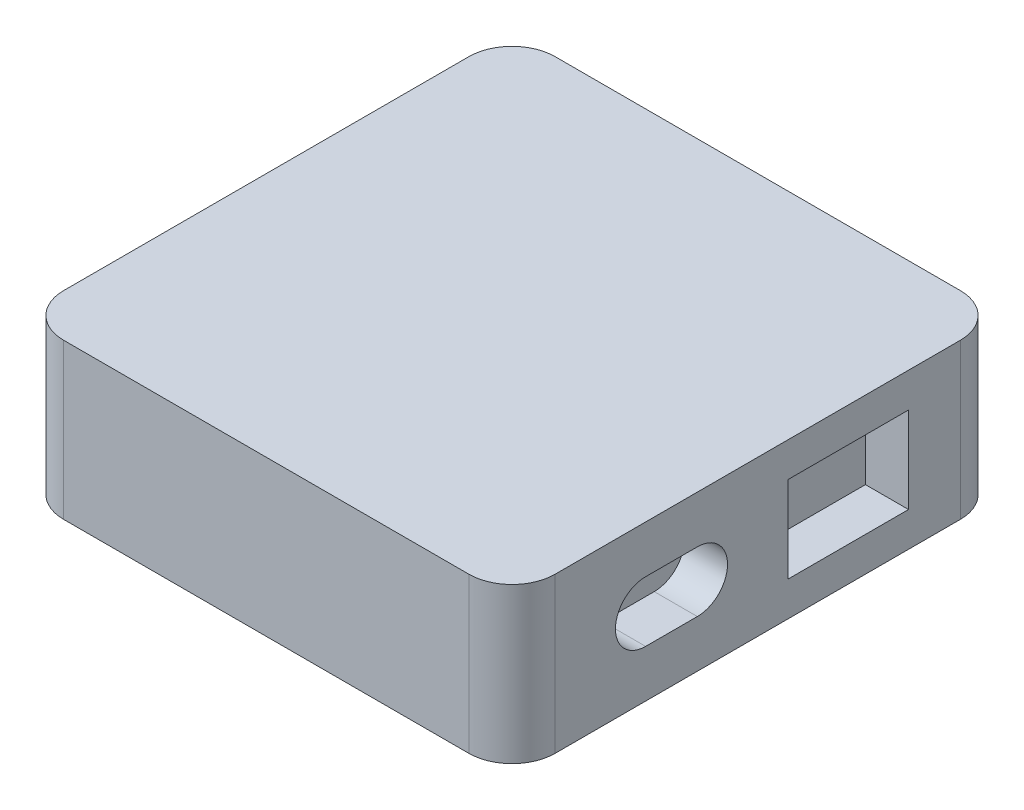
from build123d import *

# Parameters (mm, degrees)
CROQUIS1_W              = 57
CROQUIS1_H              = 57
SALIENTE_EXTRUIR1_DEPTH = 18
REDONDEO1_R             = 5
CROQUIS2_W              = 14
CROQUIS2_H              = 10
CORTAR_EXTRUIR1_DEPTH   = 5


with BuildPart() as part:
    # Croquis1 → Saliente-Extruir1 (new body)
    with BuildSketch(Plane(origin=(0, 0, 0), x_dir=(1, 0, 0), z_dir=(0, 1, 0))):
        Rectangle(CROQUIS1_W, CROQUIS1_H)
    extrude(amount=SALIENTE_EXTRUIR1_DEPTH)

    # Redondeo1
    redondeo1_edges = [part.edges().sort_by_distance(p)[0] for p in [
        (-28.5, 9, -28.5),
        (28.5, 9, -28.5),
        (28.5, 9, 28.5),
        (-28.5, 9, 28.5),
    ]]
    fillet(redondeo1_edges, radius=REDONDEO1_R)

    # Croquis2 → Cortar-Extruir1 (cut)
    with BuildSketch(Plane(origin=(28.5, 0, 0), x_dir=(0, 0, -1), z_dir=(1, 0, 0))):
        with BuildLine():
            Line((-13, 12.5), (-7, 12.5))
            ThreePointArc((-7, 12.5), (-3.5, 9), (-7, 5.5))
            Line((-7, 5.5), (-13, 5.5))
            ThreePointArc((-13, 5.5), (-16.5, 9), (-13, 12.5))
        make_face()
        with Locations((10.5, 9)):
            Rectangle(CROQUIS2_W, CROQUIS2_H)
    extrude(amount=-CORTAR_EXTRUIR1_DEPTH, mode=Mode.SUBTRACT)


solid = part.part
